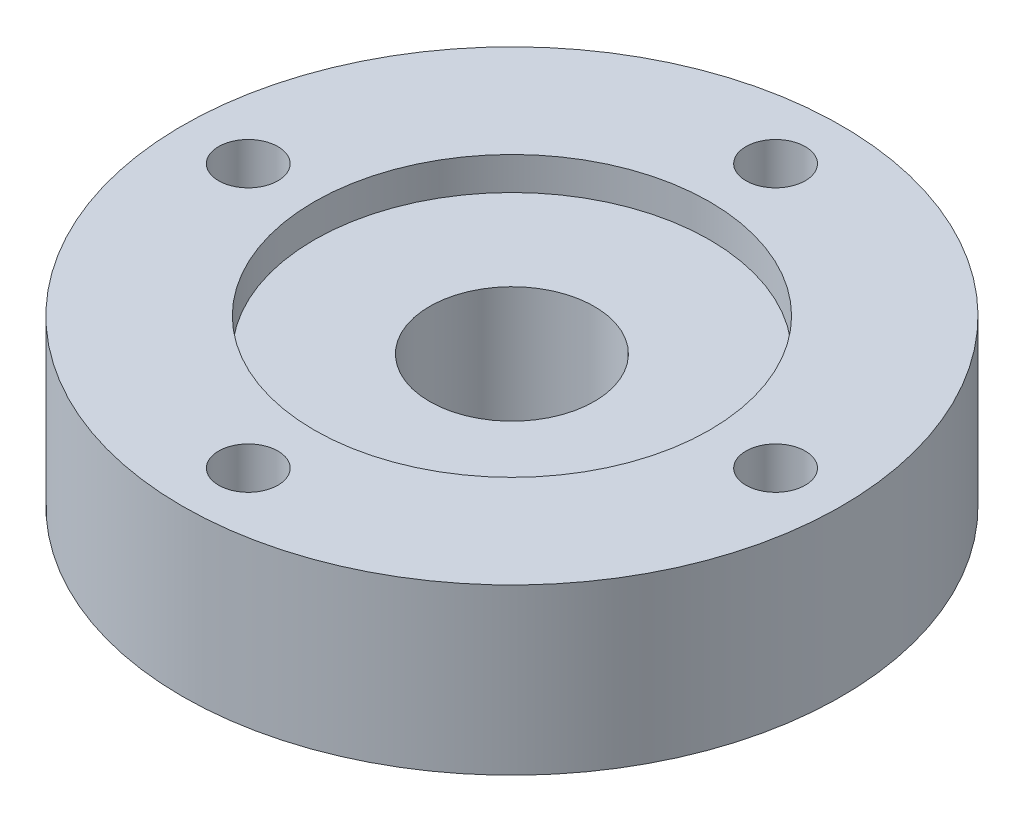
from build123d import *

# Parameters (mm, degrees)
SKETCH_1_R          = 10
SKETCH_1_R_2        = 2.5
EXTRUDE_1_DEPTH     = 5
SKETCH_2_R          = 6
CUT_EXTRUDE_1_DEPTH = 1
SKETCH_3_R          = 0.9
CUT_EXTRUDE_2_DEPTH = 16


with BuildPart() as part:
    # 草图1 → 凸台-拉伸1 (new body)
    with BuildSketch(Plane(origin=(0, 0, 0), x_dir=(1, 0, 0), z_dir=(0, 1, 0))):
        with Locations(Location((0, 0, 0), (0, 0, 270))):
            Circle(SKETCH_1_R)
        with Locations(Location((0, 0, 0), (0, 0, 270))):
            Circle(SKETCH_1_R_2, mode=Mode.SUBTRACT)
    extrude(amount=EXTRUDE_1_DEPTH)

    # 草图2 → 切除-拉伸1 (cut)
    with BuildSketch(Plane(origin=(0, 5, 0), x_dir=(1, 0, 0), z_dir=(0, 1, 0))):
        with Locations(Location((0, 0, 0), (0, 0, 270))):
            Circle(SKETCH_2_R)
    extrude(amount=-CUT_EXTRUDE_1_DEPTH, mode=Mode.SUBTRACT)

    # 草图3 → 切除-拉伸2 (cut, through all)
    with BuildSketch(Plane(origin=(0, 5, 0), x_dir=(1, 0, 0), z_dir=(0, 1, 0))):
        with Locations(Location((0, 8, 0), (0, 0, 270))):
            Circle(SKETCH_3_R)
        with Locations(Location((8, 0, 0), (0, 0, 270))):
            Circle(SKETCH_3_R)
        with Locations(Location((0, -8, 0), (0, 0, 270))):
            Circle(SKETCH_3_R)
        with Locations(Location((-8, 0, 0), (0, 0, 270))):
            Circle(SKETCH_3_R)
    extrude(amount=-CUT_EXTRUDE_2_DEPTH, mode=Mode.SUBTRACT)


solid = part.part
